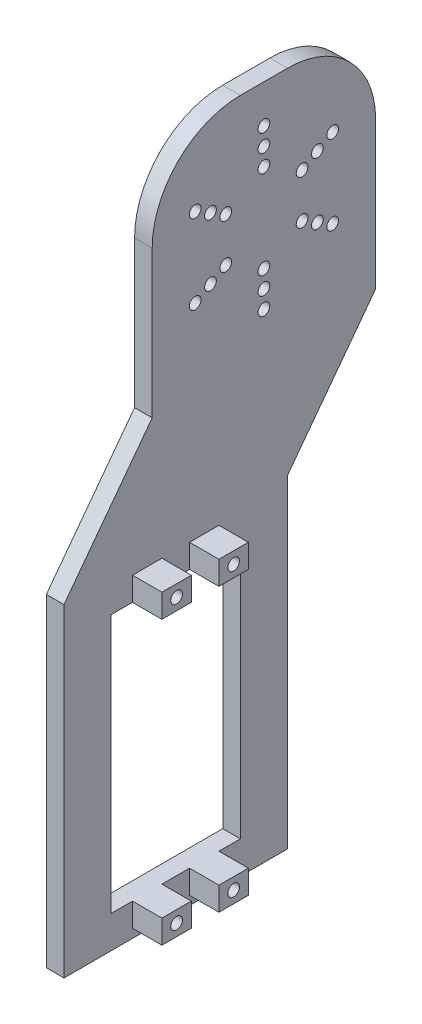
from build123d import *

# Parameters (mm, degrees)
SKETCH1_R           = 1
SKETCH1_W           = 22
SKETCH1_H           = 44
BOSS_EXTRUDE1_DEPTH = 1.5
FILLET1_R           = 15
SKETCH2_W           = 5
SKETCH2_H           = 4
SKETCH2_R           = 1
BOSS_EXTRUDE2_DEPTH = 5


with BuildPart() as part:
    # Sketch1 → Boss-Extrude1 (new, symmetric)
    with BuildSketch(Plane(origin=(0, 0, 0), x_dir=(0, 0, -1), z_dir=(1, 0, 0))):
        Polygon((-19, -27.5), (19, -27.5), (19, 27.5), (34, 47.5), (34, 87.5), (-4, 87.5), (-4, 47.5), (-19, 27.5), align=None)
        with Locations((-4.85, -24)):
            Circle(SKETCH1_R, mode=Mode.SUBTRACT)
        with Locations((4.85, -24)):
            Circle(SKETCH1_R, mode=Mode.SUBTRACT)
        with Locations((4.85, 24)):
            Circle(SKETCH1_R, mode=Mode.SUBTRACT)
        with Locations((-4.85, 24)):
            Circle(SKETCH1_R, mode=Mode.SUBTRACT)
        with Locations((15, 75)):
            Circle(SKETCH1_R, mode=Mode.SUBTRACT)
        with Locations((15, 78)):
            Circle(SKETCH1_R, mode=Mode.SUBTRACT)
        with Locations((15, 81)):
            Circle(SKETCH1_R, mode=Mode.SUBTRACT)
        with Locations((21.495190528, 71.25)):
            Circle(SKETCH1_R, mode=Mode.SUBTRACT)
        with Locations((24.09326674, 72.75)):
            Circle(SKETCH1_R, mode=Mode.SUBTRACT)
        with Locations((26.691342951, 74.25)):
            Circle(SKETCH1_R, mode=Mode.SUBTRACT)
        with Locations((21.495190528, 63.75)):
            Circle(SKETCH1_R, mode=Mode.SUBTRACT)
        with Locations((24.09326674, 62.25)):
            Circle(SKETCH1_R, mode=Mode.SUBTRACT)
        with Locations((26.691342951, 60.75)):
            Circle(SKETCH1_R, mode=Mode.SUBTRACT)
        with Locations((15, 60)):
            Circle(SKETCH1_R, mode=Mode.SUBTRACT)
        with Locations((15, 57)):
            Circle(SKETCH1_R, mode=Mode.SUBTRACT)
        with Locations((15, 54)):
            Circle(SKETCH1_R, mode=Mode.SUBTRACT)
        with Locations((8.504809472, 63.75)):
            Circle(SKETCH1_R, mode=Mode.SUBTRACT)
        with Locations((5.90673326, 62.25)):
            Circle(SKETCH1_R, mode=Mode.SUBTRACT)
        with Locations((3.308657049, 60.75)):
            Circle(SKETCH1_R, mode=Mode.SUBTRACT)
        with Locations((8.504809472, 71.25)):
            Circle(SKETCH1_R, mode=Mode.SUBTRACT)
        with Locations((5.90673326, 72.75)):
            Circle(SKETCH1_R, mode=Mode.SUBTRACT)
        with Locations((3.308657049, 74.25)):
            Circle(SKETCH1_R, mode=Mode.SUBTRACT)
        Rectangle(SKETCH1_W, SKETCH1_H, mode=Mode.SUBTRACT)
    extrude(amount=BOSS_EXTRUDE1_DEPTH, both=True)

    # Fillet1
    fillet1_edges = [part.edges().sort_by_distance(p)[0] for p in [
        (0, 87.5, 4),
        (0, 87.5, -34),
    ]]
    fillet(fillet1_edges, radius=FILLET1_R)

    # Sketch2 → Boss-Extrude2 (add)
    # profile 1 of 4: a face of its own
    with BuildSketch(Plane(origin=(1.5, 0, 0), x_dir=(0, 0, -1), z_dir=(1, 0, 0))):
        with Locations((-4.85, -24)):
            Rectangle(SKETCH2_W, SKETCH2_H)
        with Locations((-4.85, -24)):
            Circle(SKETCH2_R, mode=Mode.SUBTRACT)
    # profile 2 of 4: a face of its own
    with BuildSketch(Plane(origin=(1.5, 0, 0), x_dir=(0, 0, -1), z_dir=(1, 0, 0))):
        with Locations((4.85, -24)):
            Rectangle(SKETCH2_W, SKETCH2_H)
        with Locations((4.85, -24)):
            Circle(SKETCH2_R, mode=Mode.SUBTRACT)
    # profile 3 of 4: a face of its own
    with BuildSketch(Plane(origin=(1.5, 0, 0), x_dir=(0, 0, -1), z_dir=(1, 0, 0))):
        with Locations((4.85, 24)):
            Rectangle(SKETCH2_W, SKETCH2_H)
        with Locations((4.85, 24)):
            Circle(SKETCH2_R, mode=Mode.SUBTRACT)
    # profile 4 of 4: a face of its own
    with BuildSketch(Plane(origin=(1.5, 0, 0), x_dir=(0, 0, -1), z_dir=(1, 0, 0))):
        with Locations((-4.85, 24)):
            Rectangle(SKETCH2_W, SKETCH2_H)
        with Locations((-4.85, 24)):
            Circle(SKETCH2_R, mode=Mode.SUBTRACT)
    extrude(amount=BOSS_EXTRUDE2_DEPTH)


solid = part.part
